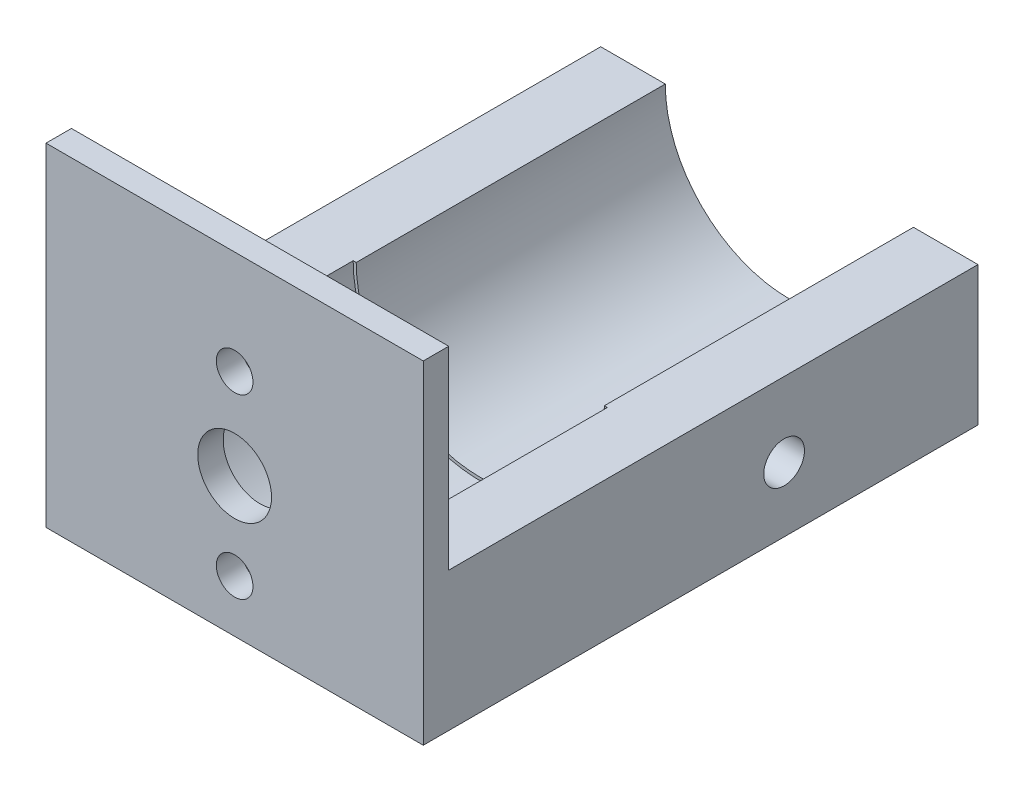
from build123d import *

# Parameters (mm, degrees)
BOSS_EXTRUDE1_DEPTH = 30.364999976
BOSS_EXTRUDE2_DEPTH = 21.63499991
SKETCH4_W           = 37.064796383
SKETCH4_H           = 32.7
SKETCH4_R           = 3.625
SKETCH4_R_2         = 1.8
BOSS_EXTRUDE3_DEPTH = 2.5
SKETCH5_R           = 2
CUT_EXTRUDE1_DEPTH  = 7
SKETCH6_R           = 2.000000064
CUT_EXTRUDE2_DEPTH  = 7
CUT_EXTRUDE3_START  = -7
SKETCH7_R           = 2
CUT_EXTRUDE3_DEPTH  = 7


with BuildPart() as part:
    # Sketch1 → Boss-Extrude1 (new body)
    with BuildSketch(Plane.XY):
        with BuildLine():
            Line((23.763847258, 19.05), (23.763847258, 5.4))
            Line((23.763847258, 5.4), (-13.300949125, 5.4))
            Line((-13.300949125, 5.4), (-13.300949125, 19.05))
            Line((-13.300949125, 19.05), (-6.958949124, 19.05))
            ThreePointArc((-6.958949124, 19.05), (5.231449067, 6.859601809), (17.421847257, 19.05))
            Line((17.421847257, 19.05), (23.763847258, 19.05))
        make_face()
    extrude(amount=BOSS_EXTRUDE1_DEPTH)

    # Sketch3 → Boss-Extrude2 (add)
    with BuildSketch(Plane.XY.offset(30.364999976)):
        with BuildLine():
            Line((-13.300949125, 19.05), (-13.300949125, 5.4))
            Line((-13.300949125, 5.4), (23.763847258, 5.4))
            Line((23.763847258, 5.4), (23.763847258, 19.05))
            Line((23.763847258, 19.05), (17.72184715, 19.05))
            ThreePointArc((17.72184715, 19.05), (5.231449012, 6.559601862), (-7.258949126, 19.05))
            Line((-7.258949126, 19.05), (-13.300949125, 19.05))
        make_face()
    extrude(amount=BOSS_EXTRUDE2_DEPTH)

    # Sketch4 → Boss-Extrude3 (add)
    with BuildSketch(Plane.XY.offset(51.999999886)):
        with Locations((5.231449067, 21.75)):
            Rectangle(SKETCH4_W, SKETCH4_H)
        with Locations((5.231449093, 19.05)):
            Circle(SKETCH4_R, mode=Mode.SUBTRACT)
        with Locations((5.231449093, 10.541)):
            Circle(SKETCH4_R_2, mode=Mode.SUBTRACT)
        with Locations((5.231449093, 27.94)):
            Circle(SKETCH4_R_2, mode=Mode.SUBTRACT)
    extrude(amount=BOSS_EXTRUDE3_DEPTH)

    # Sketch5 → Cut-Extrude1 (cut)
    with BuildSketch(Plane.XZ.offset(-5.4)):
        with Locations(Location((-8.220949125, 48.149999886, 0), (0, 0, 270))):
            Circle(SKETCH5_R)
        with Locations(Location((18.683847258, 48.149999886, 0), (0, 0, 270))):
            Circle(SKETCH5_R)
        with Locations(Location((-8.220949125, 6.35, 0), (0, 0, 270))):
            Circle(SKETCH5_R)
        with Locations(Location((18.683847258, 6.35, 0), (0, 0, 270))):
            Circle(SKETCH5_R)
    extrude(amount=-CUT_EXTRUDE1_DEPTH, mode=Mode.SUBTRACT)

    # Sketch6 → Cut-Extrude2 (cut)
    with BuildSketch(Plane.ZY.offset(13.300949125)):
        with Locations(Location((19.05, 11.75, 0), (0, 0, 270))):
            Circle(SKETCH6_R)
    extrude(amount=-CUT_EXTRUDE2_DEPTH, mode=Mode.SUBTRACT)

    # Sketch7 → Cut-Extrude3 (cut)
    with BuildSketch(Plane(origin=(23.763847258, 0, 0), x_dir=(0, 0, -1), z_dir=(1, 0, 0)).offset(CUT_EXTRUDE3_START)):
        with Locations(Location((-19.05, 11.75, 0), (0, 0, 270))):
            Circle(SKETCH7_R)
    extrude(amount=CUT_EXTRUDE3_DEPTH, mode=Mode.SUBTRACT)


solid = part.part
